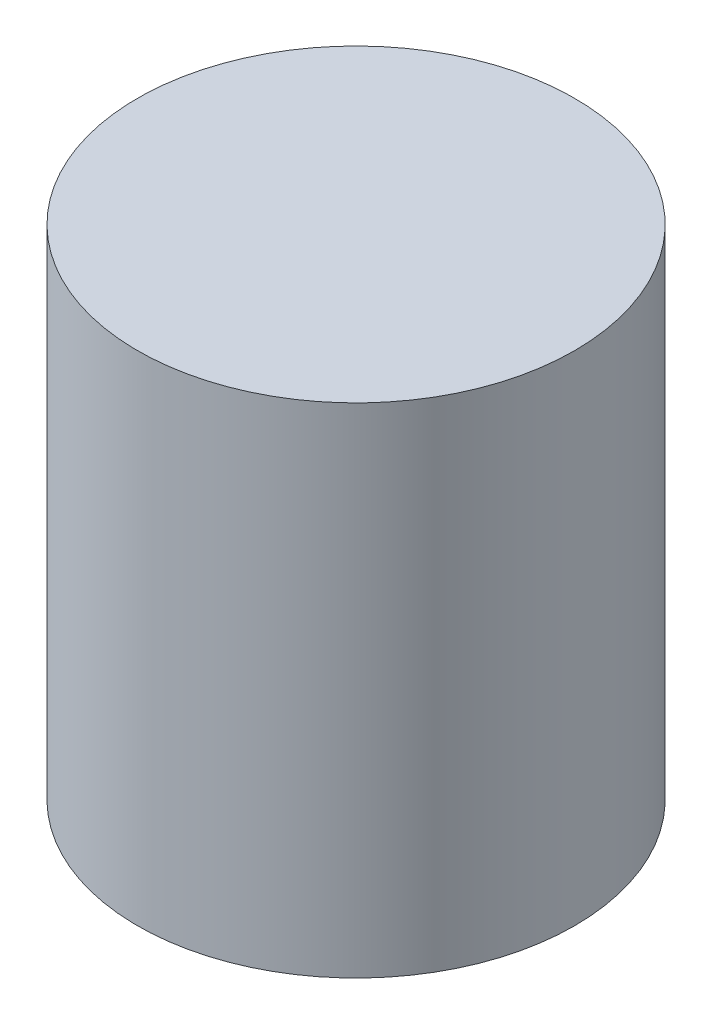
from build123d import *


with BuildPart() as part:
    # Sketch1 → Revolve1 (revolve)
    with BuildSketch(Plane.XY, mode=Mode.PRIVATE) as revolve1_sk:
        Polygon((-22.6, -14.97571636), (-22.6, 39.72428364), (0, 39.72428364), (0, 42.22428364), (-25.1, 42.22428364), (-25.1, -14.97571636), align=None)
    revolve(revolve1_sk.sketch.rotate(Axis((0, -941.701268135, 0), (0, 1, 0)), 180), axis=Axis((0, -941.701268135, 0), (0, 1, 0)))


solid = part.part
